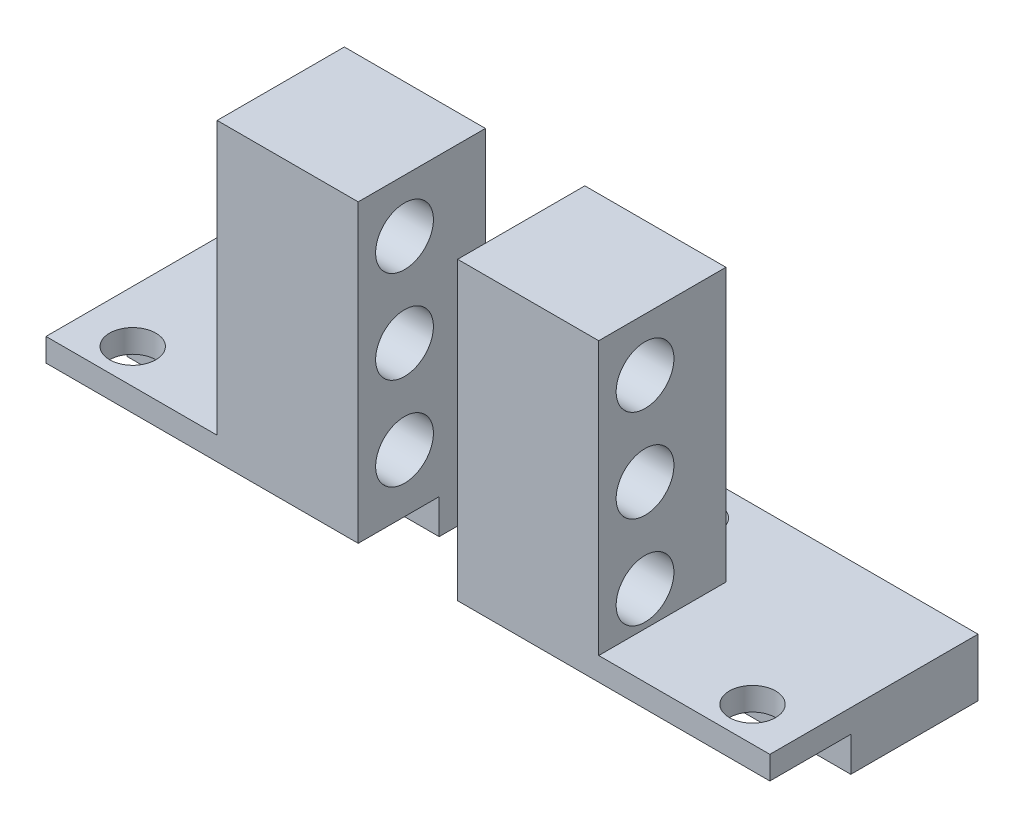
from build123d import *

# Parameters (mm, degrees)
BOSS_EXTRUDE1_DEPTH     = 18
CUT_EXTRUDE1_DEPTH      = 37.874680799
CUT_EXTRUDE1_DEPTH_BACK = 37.874680799
SKETCH2_R               = 2.5
SKETCH2_W               = 7
SKETCH2_H               = 23.578
SKETCH2_H_2             = 3
SKETCH3_R               = 2
CUT_EXTRUDE2_DEPTH      = 34.150597038
BOSS_EXTRUDE2_REACH     = 51.072
SKETCH4_W               = 7
SKETCH4_H               = 5


with BuildPart() as part:
    # Sketch1 → Boss-Extrude1 (new body)
    with BuildSketch(Plane.XY):
        Polygon((0, 0), (12.2, 0), (12.2, -28.578), (-14.8, -28.578), (-14.8, -23.578), (0, -23.578), align=None)
    extrude(amount=-BOSS_EXTRUDE1_DEPTH)

    # Sketch2 → Cut-Extrude1 (cut, two sides: drawn at the far end of the back side and taken through both)
    with BuildSketch(Plane.ZY.offset(-CUT_EXTRUDE1_DEPTH_BACK)):
        with Locations((-4.004934739, -20.578)):
            Circle(SKETCH2_R)
        with Locations((-4.004934739, -12.578)):
            Circle(SKETCH2_R)
        with Locations((-4.004934739, -4.578)):
            Circle(SKETCH2_R)
        with Locations((-14.5, -11.789)):
            Rectangle(SKETCH2_W, SKETCH2_H)
        with Locations((-3.5, -27.078)):
            Rectangle(SKETCH2_W, SKETCH2_H_2)
    extrude(amount=CUT_EXTRUDE1_DEPTH + CUT_EXTRUDE1_DEPTH_BACK, mode=Mode.SUBTRACT)

    # Sketch3 → Cut-Extrude2 (cut, through all)
    with BuildSketch(Plane(origin=(0, -23.578, 0), x_dir=(1, 0, 0), z_dir=(0, 1, 0))):
        with Locations(Location((-10.3, 3, 0), (0, 0, 270))):
            Circle(SKETCH3_R)
        with Locations(Location((6.1, 14.5, 0), (0, 0, 270))):
            Circle(SKETCH3_R)
    extrude(amount=-CUT_EXTRUDE2_DEPTH, mode=Mode.SUBTRACT)


with BuildPart() as body_2:
    # Mirror2: mirrored copy
    add(part.part.mirror(Plane(origin=(16.5, 0, 0), x_dir=(0, 0, 1), z_dir=(1, 0, 0))))

    # Sketch4 → Boss-Extrude2 (add, up to next)
    with BuildSketch(Plane(origin=(12.2, 0, 0), x_dir=(0, 0, -1), z_dir=(1, 0, 0)), mode=Mode.PRIVATE) as boss_extrude2_sk1:
        with Locations((14.5, -26.078)):
            Rectangle(SKETCH4_W, SKETCH4_H)
    boss_extrude2_tool1 = extrude(boss_extrude2_sk1.sketch, amount=BOSS_EXTRUDE2_REACH, mode=Mode.PRIVATE) - body_2.part

    add(part.part)  # Boss-Extrude2 merges part
    add(boss_extrude2_tool1.solids().sort_by_distance((12.2, -26.078, -14.5))[0])


solid = body_2.part
